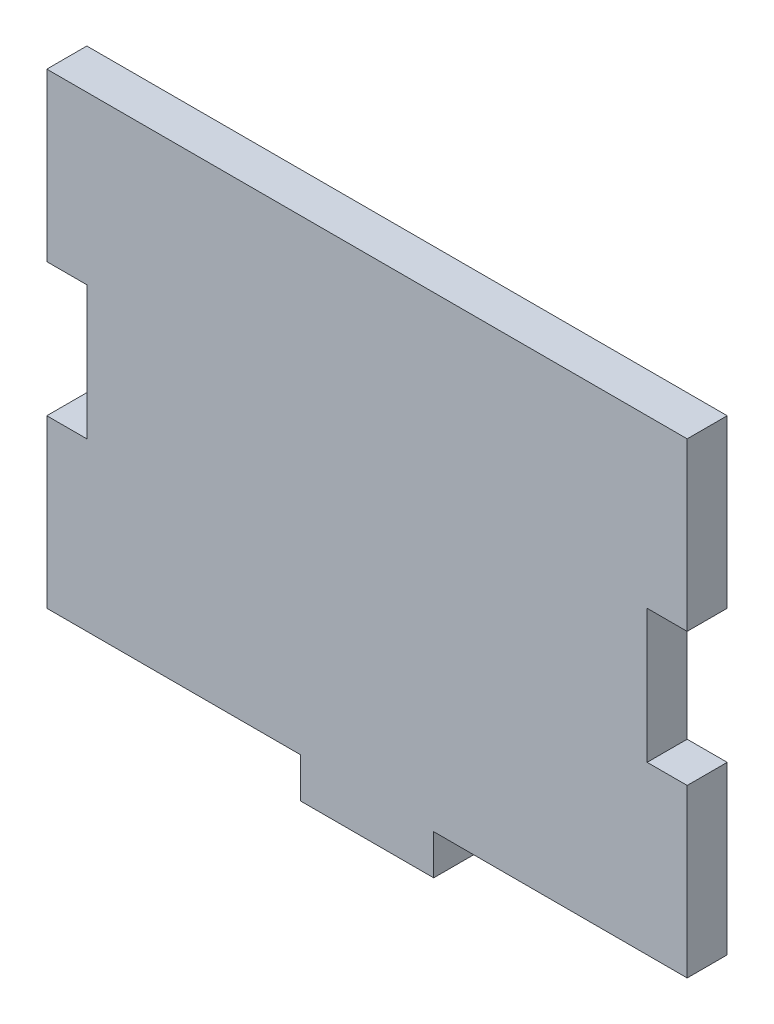
from build123d import *

# Parameters (mm, degrees)
BOSS_EXTRUDE1_DEPTH = 3


with BuildPart() as part:
    # Sketch1 → Boss-Extrude1 (new body)
    with BuildSketch(Plane.XY):
        Polygon((-5, -17.5), (-5, -20.5), (5, -20.5), (5, -17.5), (24, -17.5), (24, -5), (21, -5), (21, 5), (24, 5), (24, 17.5), (-24, 17.5), (-24, 5), (-21, 5), (-21, -5), (-24, -5), (-24, -17.5), align=None)
    extrude(amount=BOSS_EXTRUDE1_DEPTH)


solid = part.part
